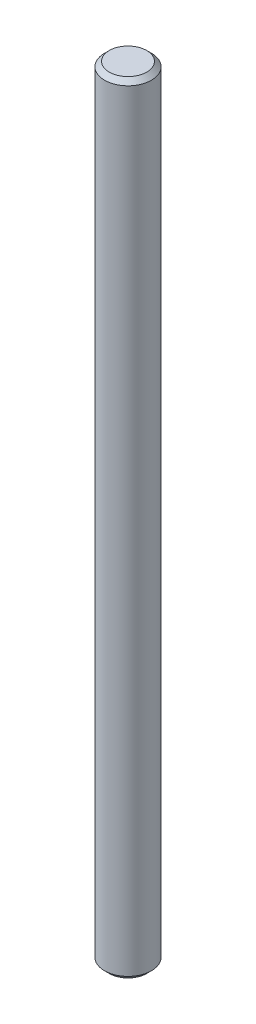
from build123d import *

# Parameters (mm, degrees)
ESQUISSE1_R        = 1.5
BOSS_EXTRU_1_DEPTH = 50
CHANFREIN1_SIZE    = 0.3


with BuildPart() as part:
    # Esquisse1 → Boss.-Extru.1 (new body)
    with BuildSketch(Plane(origin=(0, 0, 0), x_dir=(1, 0, 0), z_dir=(0, 1, 0))):
        with Locations(Location((0, 0, 0), (0, 0, 270))):
            Circle(ESQUISSE1_R)
    extrude(amount=BOSS_EXTRU_1_DEPTH)

    # Chanfrein1
    chanfrein1_edges = [part.edges().sort_by_distance(p)[0] for p in [
        (0, 0, -1.5),
        (0, 50, -1.5),
    ]]
    chamfer(chanfrein1_edges, length=CHANFREIN1_SIZE)


solid = part.part
